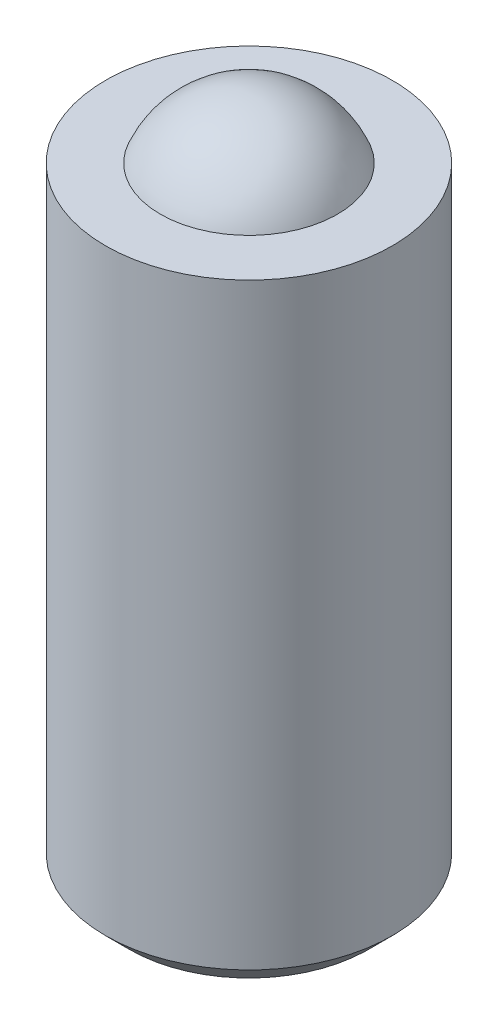
from build123d import *


with BuildPart() as part:
    # 草图1 → 旋转1 (revolve)
    with BuildSketch(Plane(origin=(0, 0, 0), x_dir=(0, 0, -1), z_dir=(1, 0, 0))):
        with BuildLine():
            Line((-3.708099244, 0), (-6, 0))
            Line((-6, 0), (-6, -25))
            Line((-6, -25), (-5, -26))
            Line((-5, -26), (0, -26))
            Line((0, -26), (0, 2.5))
            ThreePointArc((0, 2.5), (-2.236067977, 1.81662479), (-3.708099244, 0))
        make_face()
    revolve(axis=Axis((0, 46.298402486, 0), (0, -1, 0)))


solid = part.part
